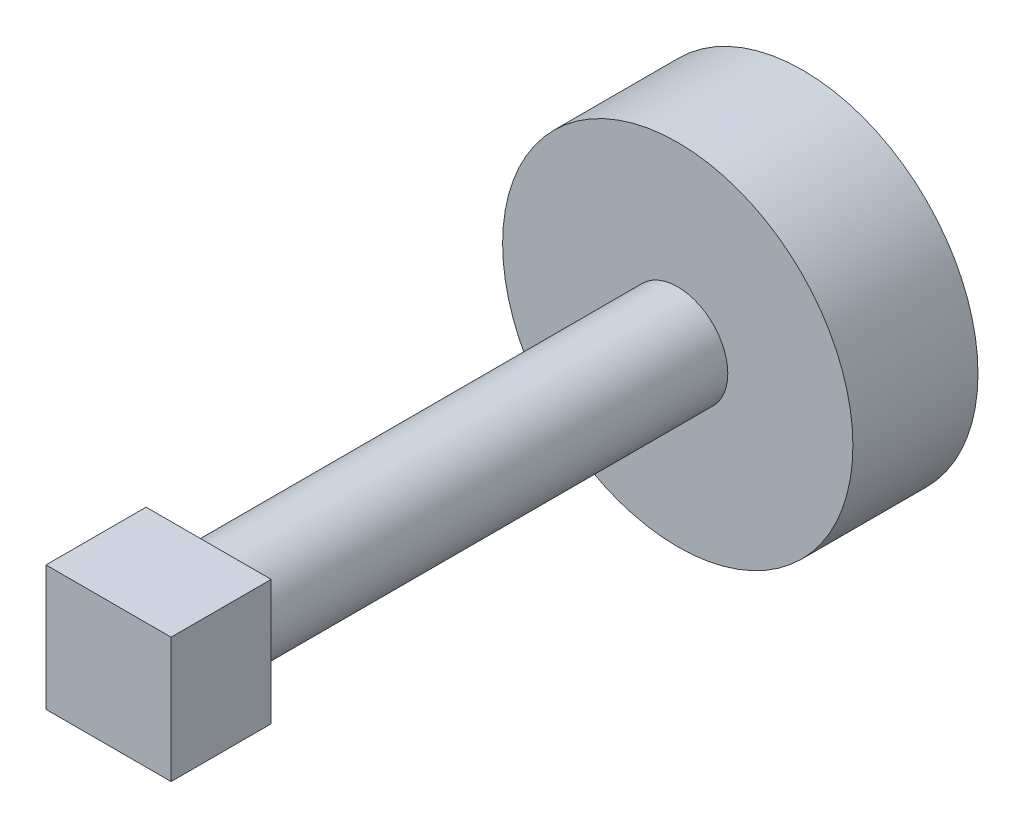
from build123d import *

# Parameters (mm, degrees)
SKETCH1_R           = 14
BOSS_EXTRUDE1_DEPTH = 10
SKETCH2_R           = 2.25
CUT_EXTRUDE1_DEPTH  = 5
SKETCH3_R           = 5
CUT_EXTRUDE2_DEPTH  = 1.8
SKETCH11_R          = 4
BOSS_EXTRUDE2_DEPTH = 37.5
SKETCH12_W          = 10
SKETCH12_H          = 10
BOSS_EXTRUDE3_DEPTH = 8


with BuildPart() as part:
    # Sketch1 → Boss-Extrude1 (new body)
    with BuildSketch(Plane.XY):
        Circle(SKETCH1_R)
    extrude(amount=BOSS_EXTRUDE1_DEPTH)

    # Sketch2 → Cut-Extrude1 (cut)
    with BuildSketch(Plane(origin=(0, 0, 0), x_dir=(-1, 0, 0), z_dir=(0, 0, -1))):
        Circle(SKETCH2_R)
    extrude(amount=-CUT_EXTRUDE1_DEPTH, mode=Mode.SUBTRACT)

    # Sketch3 → Cut-Extrude2 (cut)
    with BuildSketch(Plane(origin=(0, 0, 0), x_dir=(-1, 0, 0), z_dir=(0, 0, -1))):
        Circle(SKETCH3_R)
    extrude(amount=-CUT_EXTRUDE2_DEPTH, mode=Mode.SUBTRACT)

    # Sketch11 → Boss-Extrude2 (add)
    with BuildSketch(Plane.XY.offset(10)):
        Circle(SKETCH11_R)
    extrude(amount=BOSS_EXTRUDE2_DEPTH)

    # Sketch12 → Boss-Extrude3 (add)
    with BuildSketch(Plane.XY.offset(47.5)):
        Rectangle(SKETCH12_W, SKETCH12_H)
    extrude(amount=BOSS_EXTRUDE3_DEPTH)


solid = part.part
